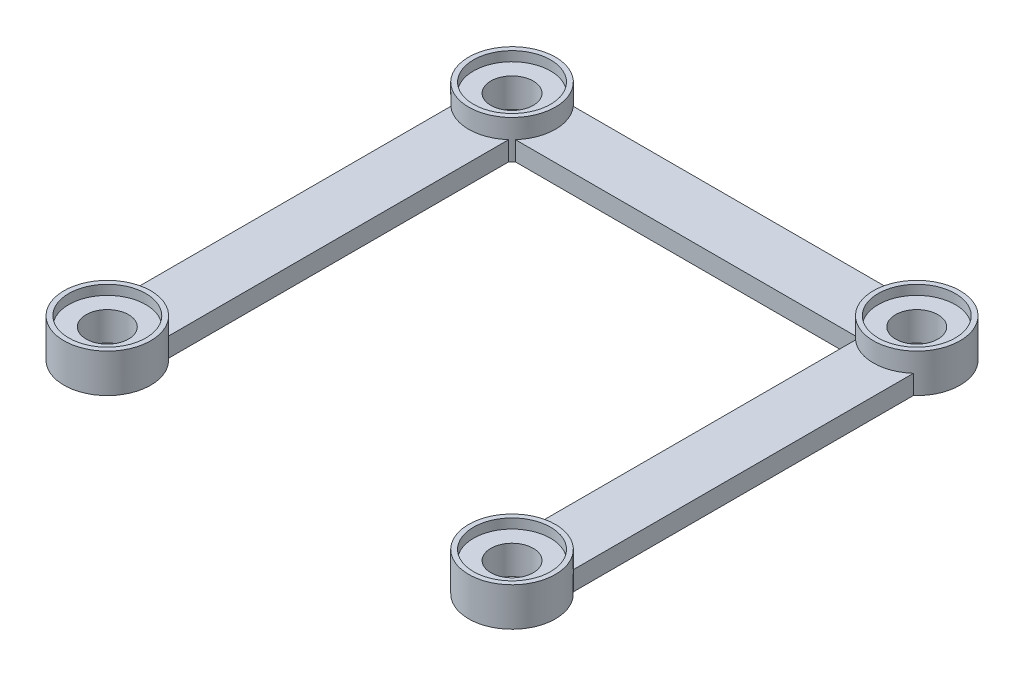
from build123d import *

# Parameters (mm, degrees)
SKETCH_1_W                   = 21
SKETCH_1_H                   = 3
EXTRUDE_1_DEPTH              = 1
SKETCH_3_W                   = 3
SKETCH_3_H                   = 21
EXTRUDE_3_DEPTH              = 1
SKETCH_2_R                   = 2.25
EXTRUDE_4_DEPTH              = 2
HOLE_WIZARD_M2_2_D           = 2.2
HOLE_WIZARD_M2_2_CBORE_D     = 4
HOLE_WIZARD_M2_2_CBORE_DEPTH = 0.5


with BuildPart() as part:
    # ｽｹｯﾁ1 → ﾎﾞｽ - 押し出し1 (new body)
    with BuildSketch(Plane(origin=(0, 0, 0), x_dir=(1, 0, 0), z_dir=(0, 1, 0))):
        Rectangle(SKETCH_1_W, SKETCH_1_H)
    extrude(amount=EXTRUDE_1_DEPTH)

    # ｽｹｯﾁ3 → ﾎﾞｽ - 押し出し3 (add)
    with BuildSketch(Plane.XZ):
        with Locations((-10.5, 10.5)):
            Rectangle(SKETCH_3_W, SKETCH_3_H)
    extrude_3 = extrude(amount=-EXTRUDE_3_DEPTH)

    # ｽｹｯﾁ2 → ﾎﾞｽ - 押し出し4 (add)
    with BuildSketch(Plane.XZ):
        with Locations(Location((-10.5, 0, 0), (0, 0, 270))):
            Circle(SKETCH_2_R)
        with Locations(Location((-10.5, 21, 0), (0, 0, 270))):
            Circle(SKETCH_2_R)
    extrude_4 = extrude(amount=-EXTRUDE_4_DEPTH)

    # M2 なべ頭ねじ用座ぐり穴2 (through all)
    with Locations(Plane(origin=(0, 2, 0), x_dir=(1, 0, 0), z_dir=(0, 1, 0))):
        with Locations((-10.5, 0), (-10.5, -21)):
            hole_wizard_m2_2 = CounterBoreHole(HOLE_WIZARD_M2_2_D / 2, HOLE_WIZARD_M2_2_CBORE_D / 2, HOLE_WIZARD_M2_2_CBORE_DEPTH)

    # ﾐﾗｰ2: ﾎﾞｽ - 押し出し3, ﾎﾞｽ - 押し出し4, M2 なべ頭ねじ用座ぐり穴2 across plane
    add(extrude_3.mirror(Plane(origin=(0, 0, 0), x_dir=(0, 0, 1), z_dir=(1, 0, 0))))
    add(extrude_4.mirror(Plane(origin=(0, 0, 0), x_dir=(0, 0, 1), z_dir=(1, 0, 0))))
    add(hole_wizard_m2_2.mirror(Plane(origin=(0, 0, 0), x_dir=(0, 0, 1), z_dir=(1, 0, 0))), mode=Mode.SUBTRACT)


solid = part.part
